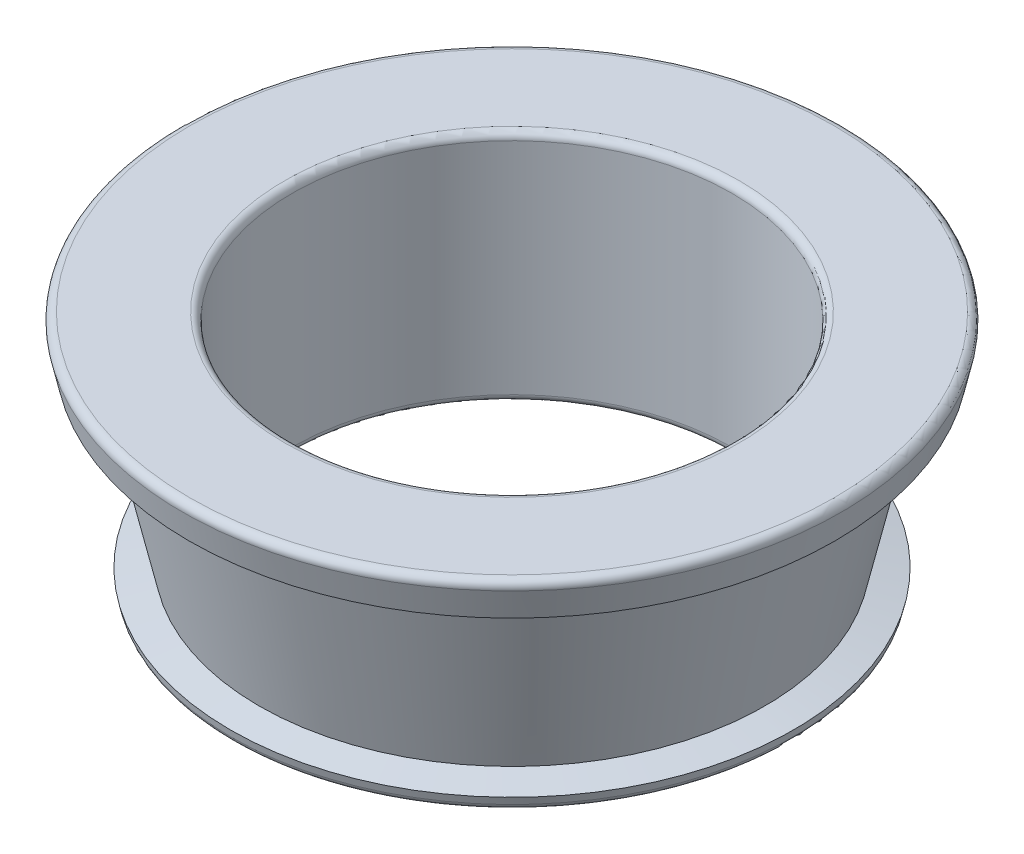
from build123d import *


with BuildPart() as part:
    # Çizim1 → Döndür1 (revolve)
    with BuildSketch(Plane.XY, mode=Mode.PRIVATE) as d_nd_r1_sk:
        with BuildLine():
            Line((0, 0.5), (0, 15.5))
            ThreePointArc((0, 15.5), (-0.146446609, 15.853553391), (-0.5, 16))
            Line((-0.5, 16), (-6.975, 16))
            ThreePointArc((-6.975, 16), (-7.365434405, 15.812347524), (-7.462804878, 15.390243902))
            Line((-7.462804878, 15.390243902), (-7.033242887, 13.481079498))
            Line((-7.033242887, 13.481079498), (-5.082023375, 13.920103888))
            Line((-5.082023375, 13.920103888), (-2.251352946, 1.339346427))
            Line((-2.251352946, 1.339346427), (-4.202572458, 0.900322037))
            Line((-4.202572458, 0.900322037), (-4.087804878, 0.390243902))
            ThreePointArc((-4.087804878, 0.390243902), (-3.912347524, 0.109565595), (-3.6, 0))
            Line((-3.6, 0), (-0.5, 0))
            ThreePointArc((-0.5, 0), (-0.146446609, 0.146446609), (0, 0.5))
        make_face()
    revolve(d_nd_r1_sk.sketch.rotate(Axis((15, 1.339346427, 0), (0, 1, 0)), 270), axis=Axis((15, 1.339346427, 0), (0, 1, 0)))


solid = part.part
